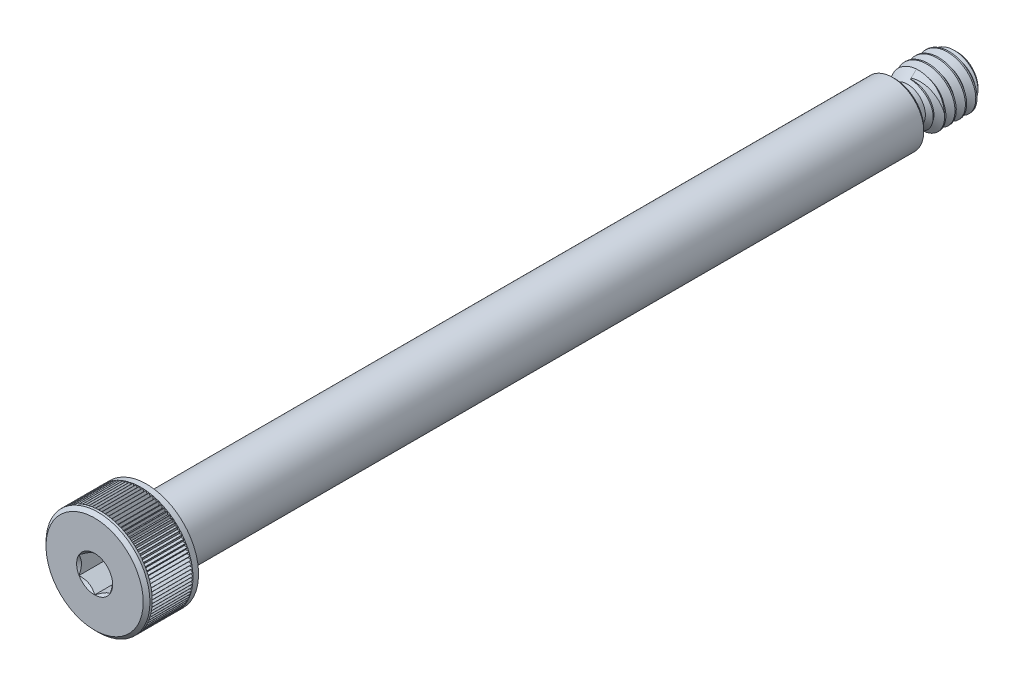
from build123d import *

# Parameters (mm, degrees)
SKETCH12_R             = 2.082800000000001
BOSS_EXTRUDE1_DEPTH    = 4.7625
CHAMFER1_SIZE          = 0.5207
CHAMFER2_SIZE          = 0.25796875
FILLET1_R              = 0.1984375
CUT_EXTRUDE2_DEPTH     = 1.984375
CUT_SWEEP1_PITCH       = 0.7937499999999998
CUT_SWEEP1_HEIGHT      = 3.968750000000007
CUT_SWEEP1_RADIUS      = 2.0828000000000015
CUT_SWEEP1_START_ANGLE = 89.99999999999982
SKETCH14_R             = 1.0414
BOSS_EXTRUDE2_DEPTH    = 3.571875
CUT_EXTRUDE5_DEPTH     = 1.5537656249999998
CIRPATTERN1_COUNT      = 99


with BuildPart() as part:
    # Sketch13 → Revolve1 (revolve)
    with BuildSketch(Plane(origin=(0, 0, 0), x_dir=(0, 0, -1), z_dir=(1, 0, 0)), mode=Mode.PRIVATE) as revolve1_sk:
        Polygon((0, 0), (1.88e-15, 3.968749999999994), (3.96875, 3.968749999999994), (3.9687500000000036, 2.1828124999999936), (4.76250000000001, 2.1828124999999936), (4.9609375000000195, 2.3812499999999934), (60.92031249999999, 2.3812499999999934), (61.11875, 2.1828124999999936), (61.11875, 0), align=None)
    revolve(revolve1_sk.sketch.rotate(Axis((0, 0, -61.11875), (0, 0, 1)), 90), axis=Axis((0, 0, -61.11875), (0, 0, 1)))

    # Sketch12 → Boss-Extrude1 (add)
    with BuildSketch(Plane(origin=(0, 0, -61.11875), x_dir=(-1, 0, 0), z_dir=(0, 0, -1))):
        Circle(SKETCH12_R)
    extrude(amount=BOSS_EXTRUDE1_DEPTH)

    # Sketch5 → Cut-Revolve1 (revolve, cut)
    with BuildSketch(Plane(origin=(0, 0, 0), x_dir=(0, 0, -1), z_dir=(1, 0, 0))):
        Polygon((61.11875, 2.082800000000001), (62.80023000000003, 2.082800000000001), (62.07125, 1.3538200000000002), (61.11875, 1.35382), align=None)
    revolve(axis=Axis((0, 6.86e-15, -61.11875), (0, -1.1e-16, 1)), mode=Mode.SUBTRACT)

    # Chamfer1
    chamfer1_edges = [part.edges().sort_by_distance(p)[0] for p in [
        (2.082800000000001, 2.6e-16, -65.88125),
    ]]
    chamfer(chamfer1_edges, length=CHAMFER1_SIZE)

    # Chamfer2
    chamfer2_edges = [part.edges().sort_by_distance(p)[0] for p in [
        (3.968749999999994, -9.3e-16, 0),
    ]]
    chamfer(chamfer2_edges, length=CHAMFER2_SIZE)

    # Fillet1
    fillet1_edges = [part.edges().sort_by_distance(p)[0] for p in [
        (-1.7e-16, -1.3538199999999863, -61.11875),
    ]]
    fillet(fillet1_edges, radius=FILLET1_R)

    # Sketch8 → Cut-Extrude2 (cut)
    with BuildSketch(Plane.XY):
        Polygon((1.1906249999999998, 0.6874076642538985), (1e-17, 1.3748153285077962), (-1.190625, 0.6874076642538981), (-1.190625, -0.6874076642538984), (3e-17, -1.3748153285077964), (1.1906249999999998, -0.6874076642538985), align=None)
    extrude(amount=-CUT_EXTRUDE2_DEPTH, mode=Mode.SUBTRACT)

    # Cut-Extrude4 cone 1 section (through the dimple's axis) → Cut-Extrude4 (revolve, cut)
    with BuildSketch(Plane(origin=(0, 0, 0), x_dir=(0, -1, 0), z_dir=(1, 0, 0))):
        Polygon((0, 0), (1.374815329, 0), (0, 1.374815329), align=None)
    revolve(axis=Axis((0, 0, 0), (0, 0, -1)), mode=Mode.SUBTRACT)


with BuildPart() as body_2:
    # Split1: the piece on the far side of the plane
    add(part.part)
    split(bisect_by=Plane.XY.offset(-61.11875), keep=Keep.BOTTOM)

    # Cut-Sweep1: sweep along a helix
    with BuildLine() as cut_sweep1_path:
        add(Helix(CUT_SWEEP1_PITCH, CUT_SWEEP1_HEIGHT, CUT_SWEEP1_RADIUS, center=(0, 0, -65.88125000000001), direction=(0, 0, 1), mode=Mode.PRIVATE).rotate(Axis((0, 0, -65.88125000000001), (0, 0, 1)), CUT_SWEEP1_START_ANGLE))
    # Sketch4 → Cut-Sweep1 (sweep, cut)
    with BuildSketch(Plane(origin=(0, 0, 0), x_dir=(0, 0, -1), z_dir=(1, 0, 0))):
        Polygon((66.17890625, 1.5672442518095777), (66.27812499999999, 1.5672442518095777), (66.6005859375, 2.12576297901587), (66.228515625, 2.12576297901587), (65.8564453125, 2.12576297901587), align=None)
    sweep(path=cut_sweep1_path.line, is_frenet=True, mode=Mode.SUBTRACT)


with BuildPart() as part_1:
    add(part.part)

    # Split1
    split(bisect_by=Plane.XY.offset(-61.11875), keep=Keep.TOP)

    add(body_2.part)  # Boss-Extrude2 merges body 2
    # Sketch14 → Boss-Extrude2 (add)
    with BuildSketch(Plane(origin=(0, 0, -61.11875), x_dir=(-1, 0, 0), z_dir=(0, 0, -1))):
        Circle(SKETCH14_R)
    extrude(amount=BOSS_EXTRUDE2_DEPTH)

    # Sketch11 → Cut-Extrude5 (cut, symmetric)
    with BuildSketch(Plane.XY.offset(-1.984375)):
        Polygon((0, 3.762374999999994), (0.11915066180400895, 3.968749999999994), (-0.11915066180400895, 3.968749999999994), align=None)
    cut_extrude5 = extrude(amount=CUT_EXTRUDE5_DEPTH, both=True, mode=Mode.SUBTRACT)

    # CirPattern1: Cut-Extrude5 ×99 about axis
    cirpattern1_axis = Axis((2e-17, -1.6e-16, 0), (0, 0, 1))
    for i in range(1, CIRPATTERN1_COUNT):
        add(cut_extrude5.rotate(cirpattern1_axis, i * 360 / CIRPATTERN1_COUNT), mode=Mode.SUBTRACT)


solid = part_1.part
